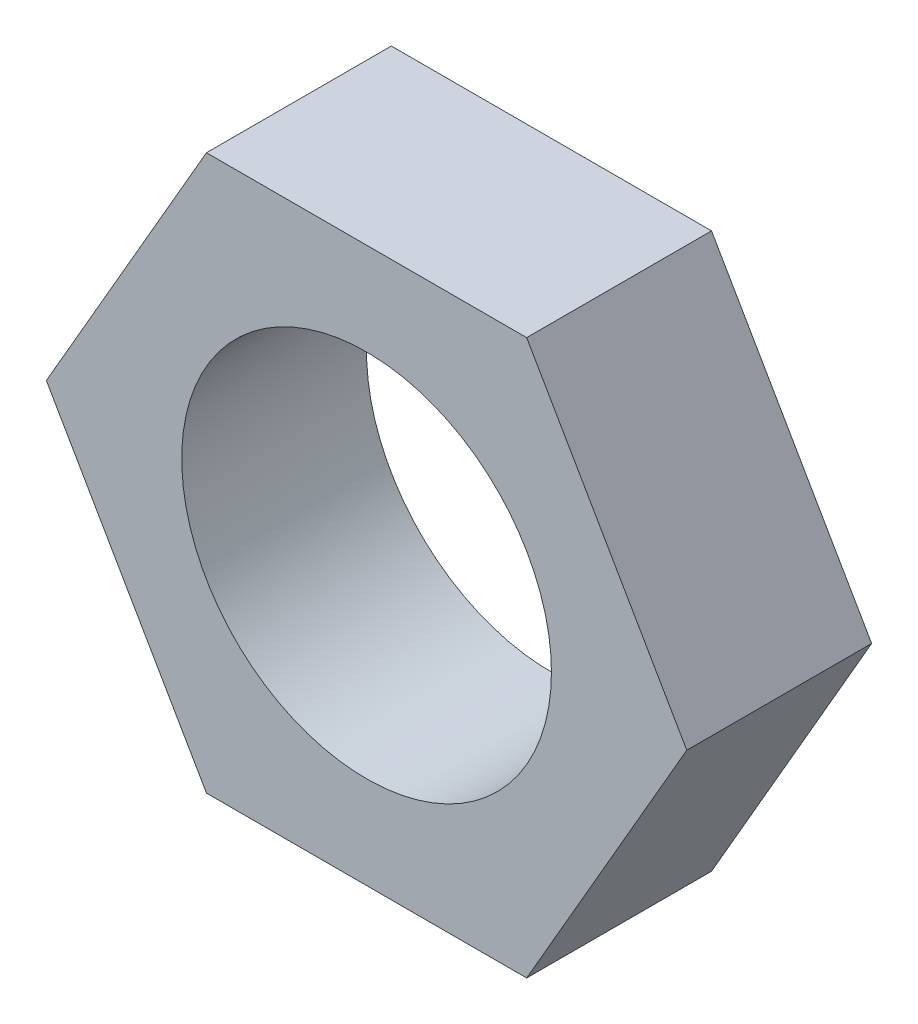
from build123d import *

# Parameters (mm, degrees)
EXTRUDE_1_DEPTH     = 5
SKETCH_2_R          = 5
CUT_EXTRUDE_1_DEPTH = 13.5


with BuildPart() as part:
    # 草图1 → 凸台-拉伸1 (new body)
    with BuildSketch(Plane.XY):
        Polygon((4.330127019, -7.5), (8.660254038, 0), (4.330127019, 7.5), (-4.330127019, 7.5), (-8.660254038, 0), (-4.330127019, -7.5), align=None)
    extrude(amount=EXTRUDE_1_DEPTH)

    # 草图2 → 切除-拉伸1 (cut, through all)
    with BuildSketch(Plane.XY.offset(5)):
        Circle(SKETCH_2_R)
    extrude(amount=-CUT_EXTRUDE_1_DEPTH, mode=Mode.SUBTRACT)


solid = part.part
